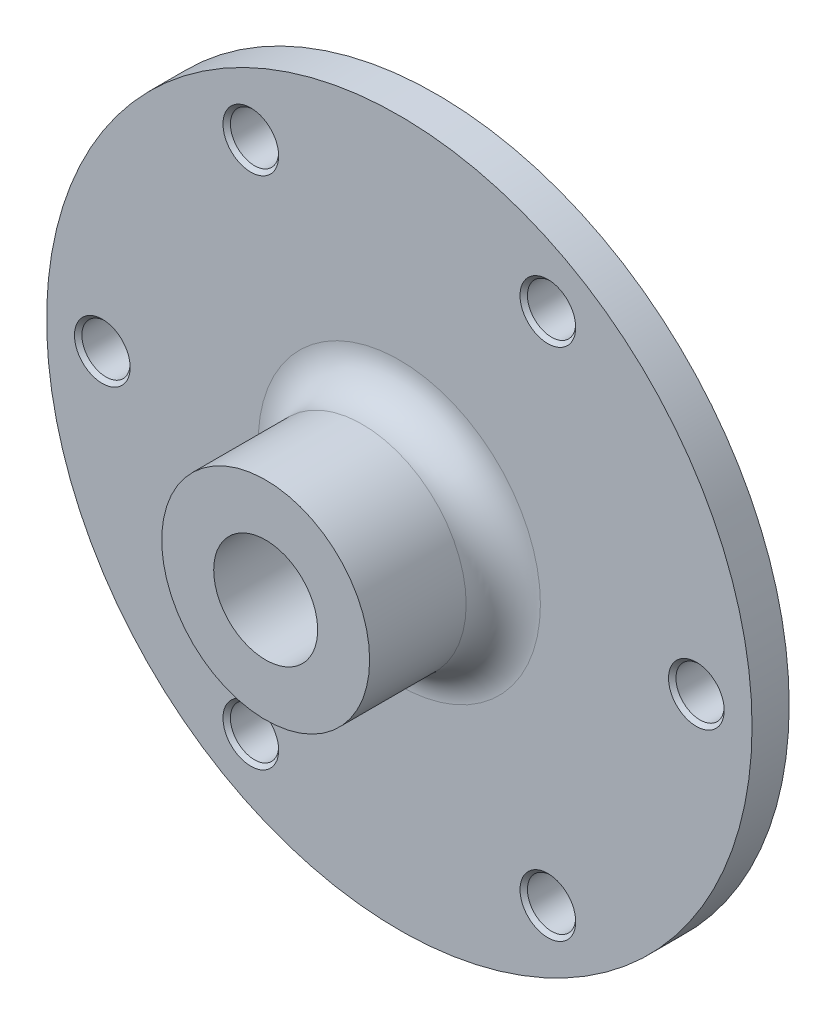
from build123d import *

# Parameters (mm, degrees)
SKETCH1_R                                            = 47.5
BOSS_EXTRUDE1_DEPTH                                  = 2.5
SKETCH2_R                                            = 35
BOSS_EXTRUDE2_DEPTH                                  = 5
SKETCH4_R                                            = 14
BOSS_EXTRUDE3_DEPTH                                  = 18
CSK_FOR_M12_HEX_SOCKET_COUNTERSUNK_CAP_S_D           = 14
CSK_FOR_M12_HEX_SOCKET_COUNTERSUNK_CAP_S_CSINK_D     = 26
CSK_FOR_M12_HEX_SOCKET_COUNTERSUNK_CAP_S_CSINK_ANGLE = 90
FILLET1_R                                            = 5
CSK_FOR_M6_HEX_SOCKET_COUNTERSUNK_CAP_SC_D           = 6.5
CSK_FOR_M6_HEX_SOCKET_COUNTERSUNK_CAP_SC_CSINK_D     = 7.5
CSK_FOR_M6_HEX_SOCKET_COUNTERSUNK_CAP_SC_CSINK_ANGLE = 90
CIRPATTERN1_COUNT                                    = 6


with BuildPart() as part:
    # Sketch1 → Boss-Extrude1 (new, symmetric)
    with BuildSketch(Plane.XY):
        Circle(SKETCH1_R)
    extrude(amount=BOSS_EXTRUDE1_DEPTH, both=True)

    # Sketch2 → Boss-Extrude2 (add)
    with BuildSketch(Plane(origin=(0, 0, -2.5), x_dir=(-1, 0, 0), z_dir=(0, 0, -1))):
        Circle(SKETCH2_R)
    extrude(amount=BOSS_EXTRUDE2_DEPTH)

    # Sketch4 → Boss-Extrude3 (add)
    with BuildSketch(Plane.XY.offset(2.5)):
        Circle(SKETCH4_R)
    extrude(amount=BOSS_EXTRUDE3_DEPTH)

    # CSK for M12 Hex Socket Countersunk Cap Screw1 (through all)
    with Locations(Plane(origin=(0, 0, -7.5), x_dir=(-1, 0, 0), z_dir=(0, 0, -1))):
        with Locations((0, 0)):
            CounterSinkHole(CSK_FOR_M12_HEX_SOCKET_COUNTERSUNK_CAP_S_D / 2, CSK_FOR_M12_HEX_SOCKET_COUNTERSUNK_CAP_S_CSINK_D / 2, counter_sink_angle=CSK_FOR_M12_HEX_SOCKET_COUNTERSUNK_CAP_S_CSINK_ANGLE)

    # Fillet1
    fillet1_edges = [part.edges().sort_by_distance(p)[0] for p in [
        (-14, 0, 2.5),
    ]]
    fillet(fillet1_edges, radius=FILLET1_R)

    # CSK for M6 Hex Socket Countersunk Cap Screw1 (through all)
    with Locations(Plane.XY.offset(2.5)):
        with Locations((-40, 0)):
            csk_for_m6_hex_socket_countersunk_cap_sc = CounterSinkHole(CSK_FOR_M6_HEX_SOCKET_COUNTERSUNK_CAP_SC_D / 2, CSK_FOR_M6_HEX_SOCKET_COUNTERSUNK_CAP_SC_CSINK_D / 2, counter_sink_angle=CSK_FOR_M6_HEX_SOCKET_COUNTERSUNK_CAP_SC_CSINK_ANGLE)

    # CirPattern1: CSK for M6 Hex Socket Countersunk Cap Screw1 ×6 about axis
    cirpattern1_axis = Axis((0, 0, 0), (0, 0, 1))
    for i in range(1, CIRPATTERN1_COUNT):
        add(csk_for_m6_hex_socket_countersunk_cap_sc.rotate(cirpattern1_axis, i * 360 / CIRPATTERN1_COUNT), mode=Mode.SUBTRACT)


solid = part.part
